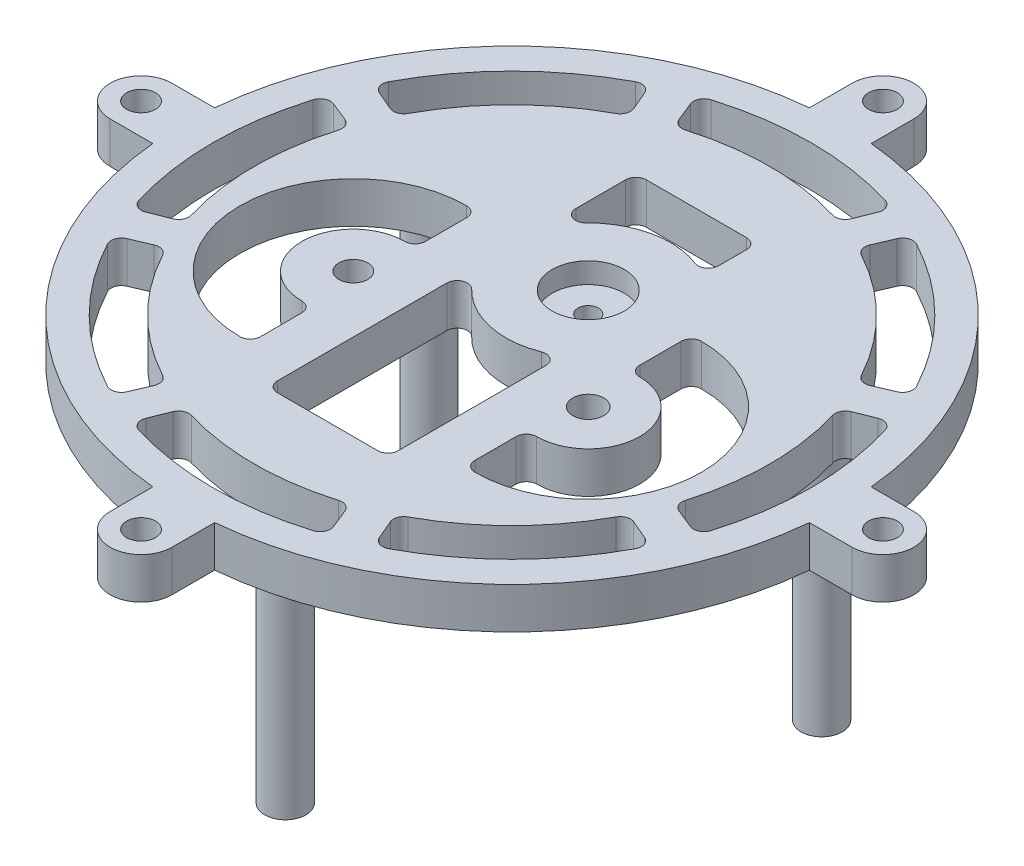
from build123d import *

# Parameters (mm, degrees)
SKETCH1_R           = 1
BOSS_EXTRUDE1_DEPTH = 13
SKETCH2_R           = 1.75
SKETCH2_R_2         = 0.7
SKETCH2_R_3         = 0.75
BOSS_EXTRUDE2_DEPTH = 2
CIRPATTERN2_COUNT   = 3
SKETCH5_R           = 1.75
SKETCH5_R_2         = 0.5
BOSS_EXTRUDE3_DEPTH = 1
CUT_EXTRUDE1_REACH  = 33.393
CIRPATTERN3_COUNT   = 8


with BuildPart() as part:
    # Sketch1 → Boss-Extrude1 (new body)
    with BuildSketch(Plane(origin=(0, 0, 0), x_dir=(1, 0, 0), z_dir=(0, 1, 0))):
        with Locations((0, -11)):
            Circle(SKETCH1_R)
    boss_extrude1 = extrude(amount=-BOSS_EXTRUDE1_DEPTH)

    # Sketch2 → Boss-Extrude2 (add)
    with BuildSketch(Plane(origin=(0, 0, 0), x_dir=(1, 0, 0), z_dir=(0, 1, 0))):
        with BuildLine():
            Line((-18, 1.5), (-15.929532322, 1.5))
            ThreePointArc((-15.929532322, 1.5), (-11.313708499, 11.313708499), (-1.5, 15.929532322))
            Line((-1.5, 15.929532322), (-1.5, 18))
            ThreePointArc((-1.5, 18), (0, 19.5), (1.5, 18))
            Line((1.5, 18), (1.5, 15.929532322))
            ThreePointArc((1.5, 15.929532322), (11.313708499, 11.313708499), (15.929532322, 1.5))
            Line((15.929532322, 1.5), (18, 1.5))
            ThreePointArc((18, 1.5), (19.5, 0), (18, -1.5))
            Line((18, -1.5), (15.929532322, -1.5))
            ThreePointArc((15.929532322, -1.5), (11.313708499, -11.313708499), (1.5, -15.929532322))
            Line((1.5, -15.929532322), (1.5, -18))
            ThreePointArc((1.5, -18), (0, -19.5), (-1.5, -18))
            Line((-1.5, -18), (-1.5, -15.929532322))
            ThreePointArc((-1.5, -15.929532322), (-11.313708499, -11.313708499), (-15.929532322, -1.5))
            Line((-15.929532322, -1.5), (-18, -1.5))
            ThreePointArc((-18, -1.5), (-19.5, 0), (-18, 1.5))
        make_face()
        with Locations((0.8, 2.9)):
            Circle(SKETCH2_R, mode=Mode.SUBTRACT)
        with Locations((0, 18)):
            Circle(SKETCH2_R_2, mode=Mode.SUBTRACT)
        with Locations((18, 0)):
            Circle(SKETCH2_R_2, mode=Mode.SUBTRACT)
        with Locations((-18, 0)):
            Circle(SKETCH2_R_2, mode=Mode.SUBTRACT)
        with Locations((0, -18)):
            Circle(SKETCH2_R_2, mode=Mode.SUBTRACT)
        with Locations((-5.7, -2)):
            Circle(SKETCH2_R_2, mode=Mode.SUBTRACT)
        with Locations((5.7, -2)):
            Circle(SKETCH2_R_3, mode=Mode.SUBTRACT)
        with BuildLine():
            Line((-5.2, 3), (-5.2, 1))
            ThreePointArc((-5.2, 1), (-5.346446609, 0.646446609), (-5.7, 0.5))
            ThreePointArc((-5.7, 0.5), (-8.2, -2), (-5.7, -4.5))
            ThreePointArc((-5.7, -4.5), (-5.346446609, -4.646446609), (-5.2, -5))
            Line((-5.2, -5), (-5.2, -7))
            ThreePointArc((-5.2, -7), (-5.346446609, -7.353553391), (-5.7, -7.5))
            ThreePointArc((-5.7, -7.5), (-11.2, -2), (-5.7, 3.5))
            ThreePointArc((-5.7, 3.5), (-5.346446609, 3.353553391), (-5.2, 3))
        make_face(mode=Mode.SUBTRACT)
        with BuildLine():
            Line((2.934458944, -1.292677422), (2.934458944, -8.449761431))
            ThreePointArc((2.934458944, -8.449761431), (2.788012334, -8.803314822), (2.434458944, -8.949761431))
            Line((2.434458944, -8.949761431), (-2.434458944, -8.949761431))
            ThreePointArc((-2.434458944, -8.949761431), (-2.788012334, -8.803314822), (-2.934458944, -8.449761431))
            Line((-2.934458944, -8.449761431), (-2.934458944, -0.228621956))
            ThreePointArc((-2.934458944, -0.228621956), (-2.621952726, 0.234892965), (-2.075074617, 0.119002706))
            ThreePointArc((-2.075074617, 0.119002706), (-0.054005989, -1.007770947), (2.252852394, -0.826824375))
            ThreePointArc((2.252852394, -0.826824375), (2.716590762, -0.87988009), (2.934458944, -1.292677422))
        make_face(mode=Mode.SUBTRACT)
        with BuildLine():
            Line((-2.434458944, 8.949761431), (2.434458944, 8.949761431))
            ThreePointArc((2.434458944, 8.949761431), (2.788012334, 8.803314822), (2.934458944, 8.449761431))
            Line((2.934458944, 8.449761431), (2.934458944, 7.092677422))
            ThreePointArc((2.934458944, 7.092677422), (2.716590762, 6.67988009), (2.252852394, 6.626824375))
            ThreePointArc((2.252852394, 6.626824375), (-0.054005989, 6.807770947), (-2.075074617, 5.680997294))
            ThreePointArc((-2.075074617, 5.680997294), (-2.621952726, 5.565107035), (-2.934458944, 6.028621956))
            Line((-2.934458944, 6.028621956), (-2.934458944, 8.449761431))
            ThreePointArc((-2.934458944, 8.449761431), (-2.788012334, 8.803314822), (-2.434458944, 8.949761431))
        make_face(mode=Mode.SUBTRACT)
        with BuildLine():
            Line((5.2, -5), (5.2, -7))
            ThreePointArc((5.2, -7), (5.346446609, -7.353553391), (5.7, -7.5))
            ThreePointArc((5.7, -7.5), (11.2, -2), (5.7, 3.5))
            ThreePointArc((5.7, 3.5), (5.346446609, 3.353553391), (5.2, 3))
            Line((5.2, 3), (5.2, 1))
            ThreePointArc((5.2, 1), (5.346446609, 0.646446609), (5.7, 0.5))
            ThreePointArc((5.7, 0.5), (8.2, -2), (5.7, -4.5))
            ThreePointArc((5.7, -4.5), (5.346446609, -4.646446609), (5.2, -5))
        make_face(mode=Mode.SUBTRACT)
    extrude(amount=BOSS_EXTRUDE2_DEPTH)

    # CirPattern2: Boss-Extrude1 ×3 about axis
    cirpattern2_axis = Axis((0, 0.65, 0), (0, -1, 0))
    for i in range(1, CIRPATTERN2_COUNT):
        add(boss_extrude1.rotate(cirpattern2_axis, i * 360 / CIRPATTERN2_COUNT))

    # Sketch5 → Boss-Extrude3 (add)
    with BuildSketch(Plane.XZ):
        with Locations((0.8, -2.9)):
            Circle(SKETCH5_R)
        with Locations((0.8, -2.9)):
            Circle(SKETCH5_R_2, mode=Mode.SUBTRACT)
    extrude(amount=-BOSS_EXTRUDE3_DEPTH)

    # Sketch8 → Cut-Extrude1 (cut, up to next)
    with BuildSketch(Plane(origin=(0, 2, 0), x_dir=(1, 0, 0), z_dir=(0, 1, 0)), mode=Mode.PRIVATE) as cut_extrude1_sk1:
        with BuildLine():
            Line((4.176910704, 12.28097457), (4.551006159, 13.213456818))
            ThreePointArc((4.551006159, 13.213456818), (4.537914561, 13.615582258), (4.232825837, 13.877874327))
            ThreePointArc((4.232825837, 13.877874327), (0, 14.509038921), (-4.232825837, 13.877874327))
            ThreePointArc((-4.232825837, 13.877874327), (-4.537914561, 13.615582258), (-4.551006159, 13.213456818))
            Line((-4.551006159, 13.213456818), (-4.176910704, 12.28097457))
            ThreePointArc((-4.176910704, 12.28097457), (-3.930304731, 12.016900024), (-3.570150171, 11.987942034))
            ThreePointArc((-3.570150171, 11.987942034), (0, 12.508266325), (3.570150171, 11.987942034))
            ThreePointArc((3.570150171, 11.987942034), (3.930304731, 12.016900024), (4.176910704, 12.28097457))
        make_face()
    cut_extrude1_tool1 = extrude(cut_extrude1_sk1.sketch, amount=-CUT_EXTRUDE1_REACH, mode=Mode.PRIVATE) & part.part
    cut_extrude1 = cut_extrude1_tool1.solids().sort_by_distance((0, 2, -13.296858))[0]
    add(cut_extrude1, mode=Mode.SUBTRACT)

    # CirPattern3: Cut-Extrude1 ×8 about axis
    cirpattern3_axis = Axis((0, 0.65, 0), (0, -1, 0))
    for i in range(1, CIRPATTERN3_COUNT):
        add(cut_extrude1.rotate(cirpattern3_axis, i * 360 / CIRPATTERN3_COUNT), mode=Mode.SUBTRACT)


solid = part.part
